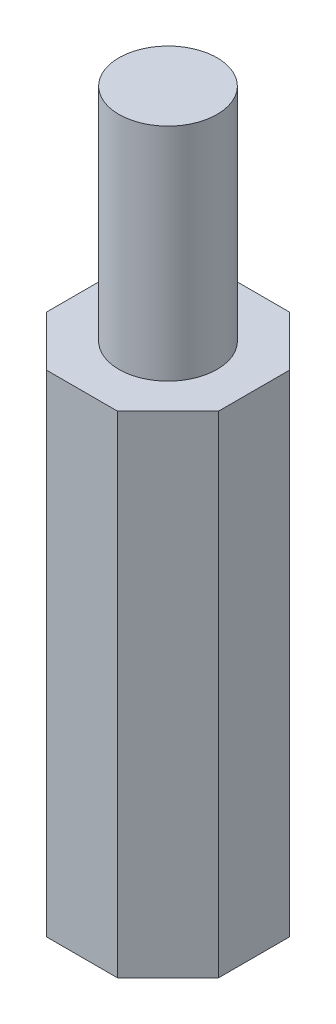
from build123d import *

# Parameters (mm, degrees)
EXTRUSION1_DEPTH        = 10
ESQUISSE2_R             = 2
EXTRUSION2_DEPTH        = 9
ESQUISSE3_R             = 2
ENL_V_MAT_EXTRU_1_DEPTH = 9


with BuildPart() as part:
    # Esquisse1 → Extrusion1 (new, symmetric)
    with BuildSketch(Plane(origin=(0, 0, 0), x_dir=(1, 0, 0), z_dir=(0, 1, 0))):
        Polygon((-1.449747468, 3.5), (1.449747468, 3.5), (3.5, 1.449747468), (3.5, -1.449747468), (1.449747468, -3.5), (-1.449747468, -3.5), (-3.5, -1.449747468), (-3.5, 1.449747468), align=None)
    extrude(amount=EXTRUSION1_DEPTH, both=True)

    # Esquisse2 → Extrusion2 (add)
    with BuildSketch(Plane(origin=(0, 10, 0), x_dir=(1, 0, 0), z_dir=(0, 1, 0))):
        with Locations(Location((0, 0, 0), (0, 0, 270))):
            Circle(ESQUISSE2_R)
    extrude(amount=EXTRUSION2_DEPTH)

    # Esquisse3 → Enlèv. mat.-Extru.1 (cut)
    with BuildSketch(Plane.XZ.offset(10)):
        with Locations(Location((0, 0, 0), (0, 0, 90))):
            Circle(ESQUISSE3_R)
    extrude(amount=-ENL_V_MAT_EXTRU_1_DEPTH, mode=Mode.SUBTRACT)


solid = part.part
